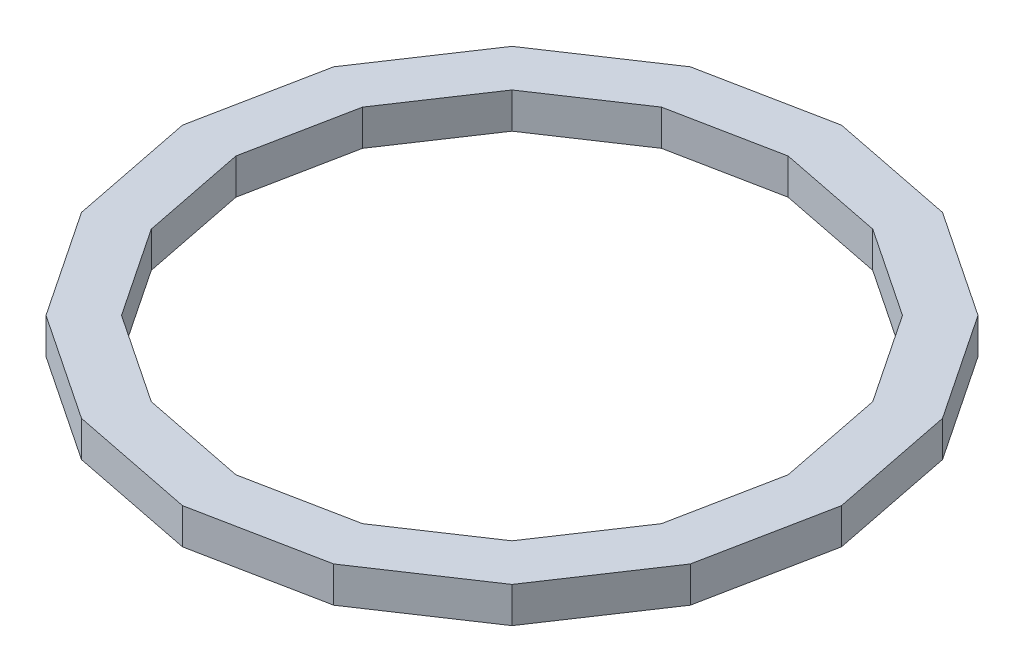
from build123d import *

# Parameters (mm, degrees)
BOSS_EXTRUDE1_DEPTH = 19.05


with BuildPart() as part:
    # Sketch1 → Boss-Extrude1 (new body)
    with BuildSketch(Plane(origin=(0, 0, 0), x_dir=(1, 0, 0), z_dir=(0, 1, 0))):
        Polygon((175.764741406, 0), (162.385447122, 67.26225453), (124.284440542, 124.284440542), (67.26225453, 162.385447122), (0, 175.764741406), (-67.26225453, 162.385447122), (-124.284440542, 124.284440542), (-162.385447122, 67.26225453), (-175.764741406, 0), (-162.385447122, -67.26225453), (-124.284440542, -124.284440542), (-67.26225453, -162.385447122), (0, -175.764741406), (67.26225453, -162.385447122), (124.284440542, -124.284440542), (162.385447122, -67.26225453), align=None)
        Polygon((147.277364446, 0), (136.066542614, 56.360607336), (104.140823115, 104.140823115), (56.360607336, 136.066542614), (0, 147.277364446), (-56.360607336, 136.066542614), (-104.140823115, 104.140823115), (-136.066542614, 56.360607336), (-147.277364446, 0), (-136.066542614, -56.360607336), (-104.140823115, -104.140823115), (-56.360607336, -136.066542614), (0, -147.277364446), (56.360607336, -136.066542614), (104.140823115, -104.140823115), (136.066542614, -56.360607336), align=None, mode=Mode.SUBTRACT)
    extrude(amount=BOSS_EXTRUDE1_DEPTH)


solid = part.part
